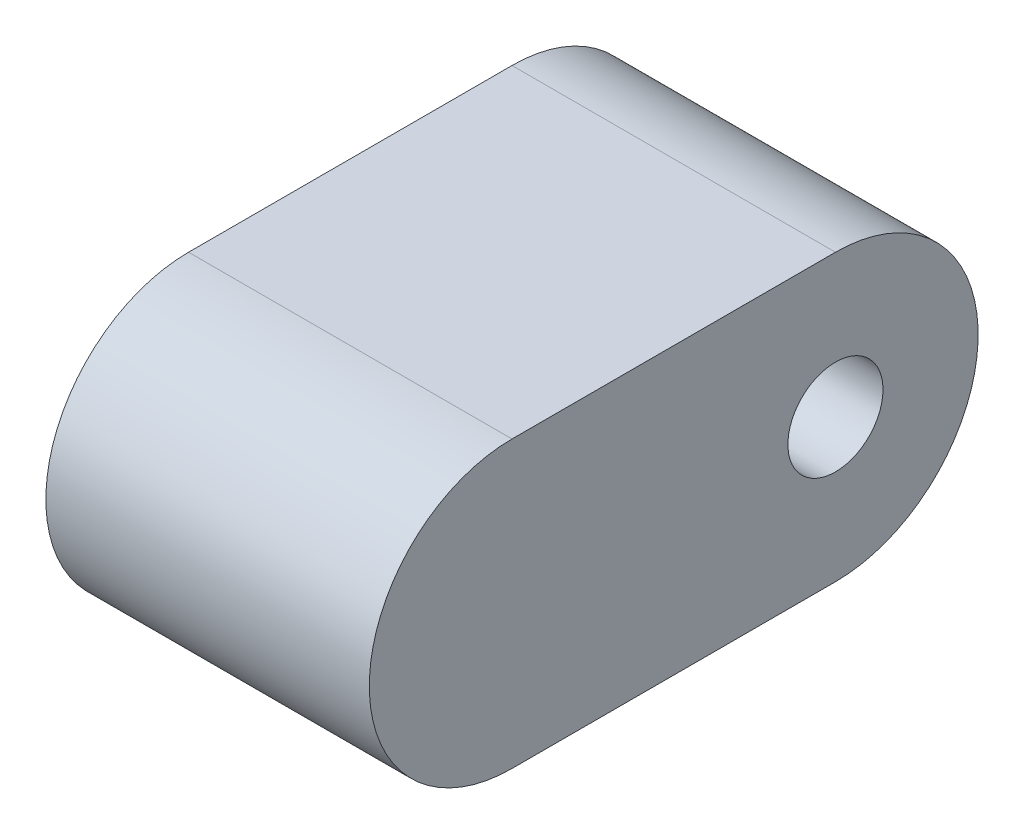
from build123d import *

# Parameters (mm, degrees)
CROQUIS1_R              = 2.5
SALIENTE_EXTRUIR1_DEPTH = 8.5


with BuildPart() as part:
    # Croquis1 → Saliente-Extruir1 (new, symmetric)
    with BuildSketch(Plane(origin=(0, 0, 0), x_dir=(0, 0, -1), z_dir=(1, 0, 0))):
        with BuildLine():
            Line((0, 7.5), (-17, 7.5))
            ThreePointArc((-17, 7.5), (-24.5, 0), (-17, -7.5))
            Line((-17, -7.5), (0, -7.5))
            ThreePointArc((0, -7.5), (7.5, 0), (0, 7.5))
        make_face()
        Circle(CROQUIS1_R, mode=Mode.SUBTRACT)
    extrude(amount=SALIENTE_EXTRUIR1_DEPTH, both=True)


solid = part.part
